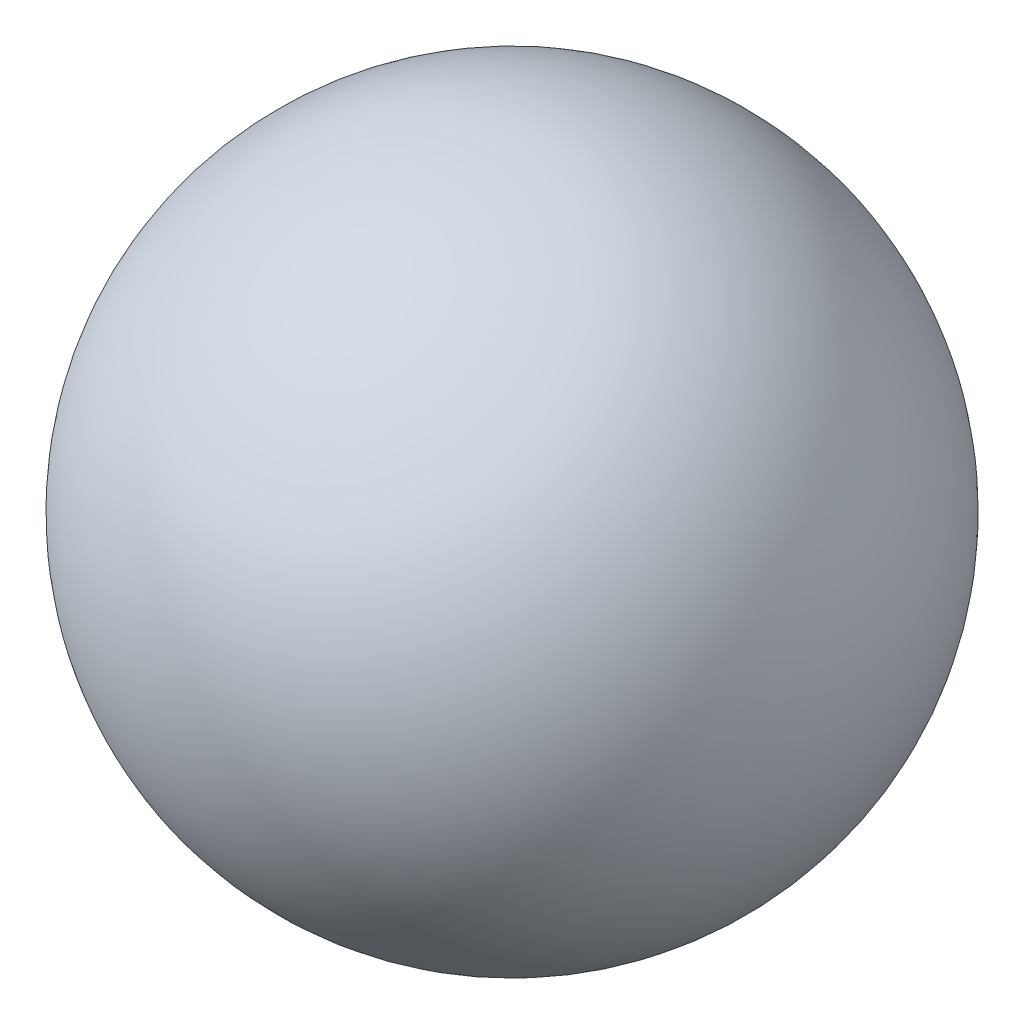
from build123d import *


with BuildPart() as part:
    # 草图1 → 旋转1 (revolve)
    with BuildSketch(Plane(origin=(0, 37.5, 0), x_dir=(1, 0, 0), z_dir=(0, 1, 0))):
        with BuildLine():
            Line((5, 2.778), (5, -2.778))
            ThreePointArc((5, -2.778), (7.778, 0), (5, 2.778))
        make_face()
    revolve(axis=Axis((5, 37.5, -2.778), (0, 0, 1)))


solid = part.part
